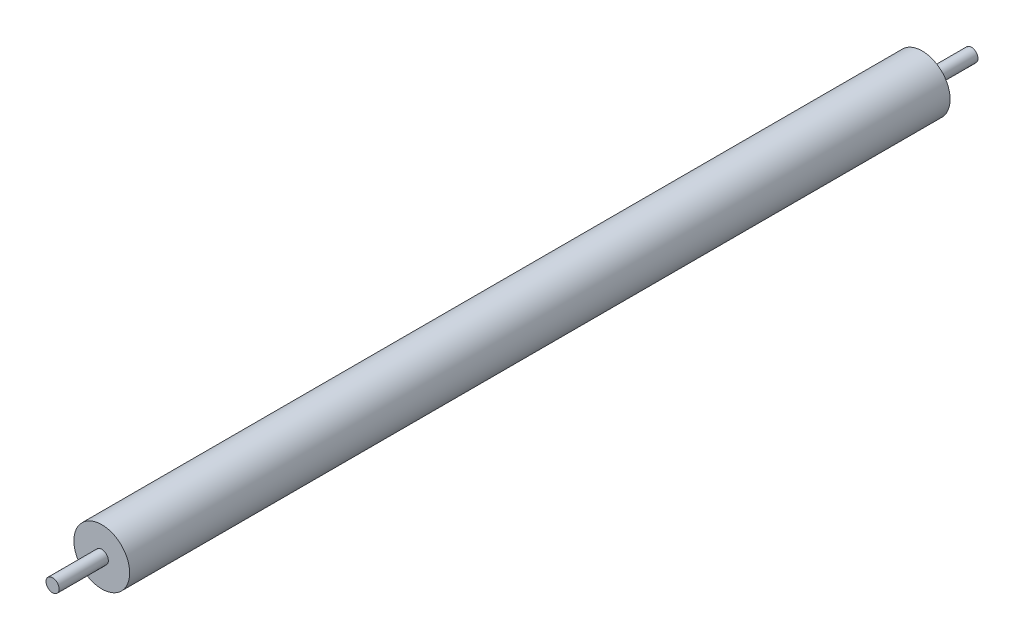
from build123d import *

# Parameters (mm, degrees)
SKETCH1_R           = 4
BOSS_EXTRUDE1_DEPTH = 560
SKETCH2_R           = 17
BOSS_EXTRUDE2_DEPTH = 250


with BuildPart() as part:
    # Sketch1 → Boss-Extrude1 (new body)
    with BuildSketch(Plane.XY):
        Circle(SKETCH1_R)
    extrude(amount=BOSS_EXTRUDE1_DEPTH)

    # Sketch2 → Boss-Extrude2 (add, symmetric)
    with BuildSketch(Plane.XY.offset(280)):
        Circle(SKETCH2_R)
    extrude(amount=BOSS_EXTRUDE2_DEPTH, both=True)


solid = part.part
